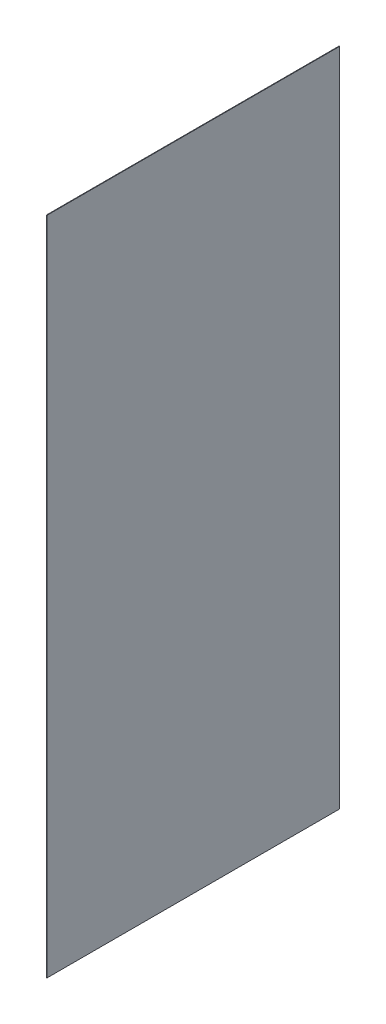
from build123d import *

# Parameters (mm, degrees)
SKETCH1_W                = 1.5
SKETCH1_H                = 1850
OVEN_DIS_YAN_SAG_1_DEPTH = 820


with BuildPart() as part:
    # Sketch1 → OVEN_dis_yan_sag_1 (new body)
    with BuildSketch(Plane.XY):
        with Locations((699.25, 1045)):
            Rectangle(SKETCH1_W, SKETCH1_H)
    extrude(amount=-OVEN_DIS_YAN_SAG_1_DEPTH)


solid = part.part
